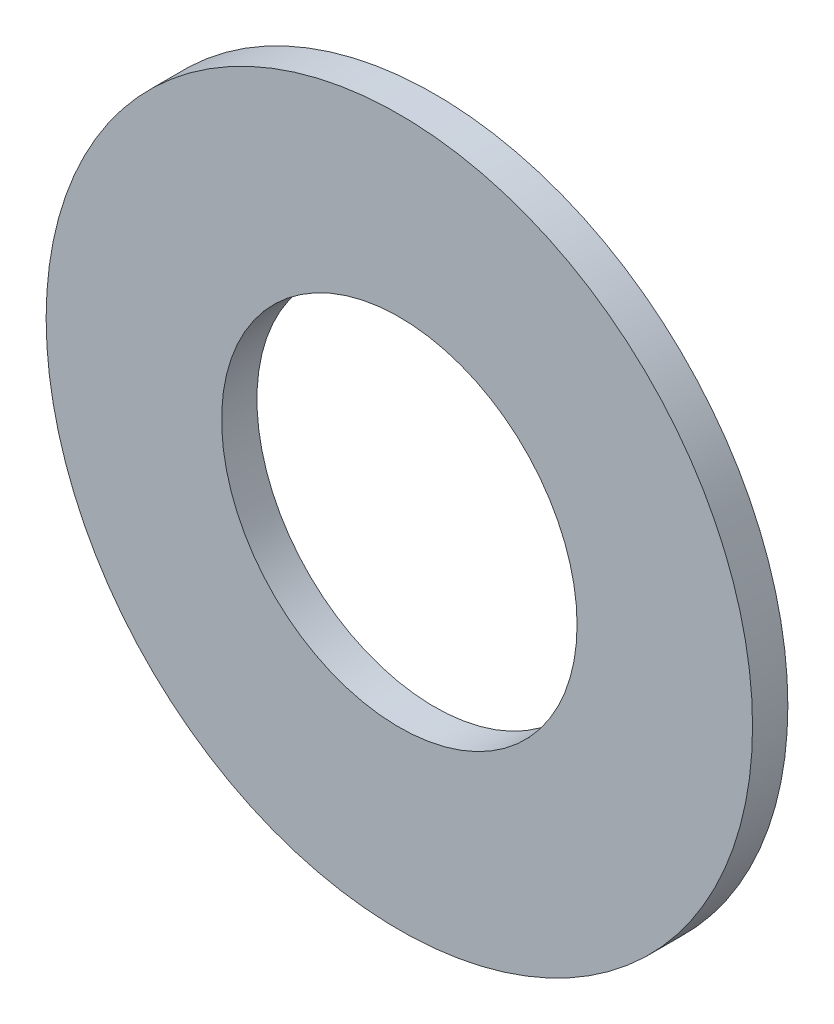
from build123d import *

# Parameters (mm, degrees)
SKETCH3_R           = 15.875
SKETCH3_R_2         = 7.9883
BOSS_EXTRUDE1_DEPTH = 0.79375


with BuildPart() as part:
    # Sketch3 → Boss-Extrude1 (new, symmetric)
    with BuildSketch(Plane.XY):
        Circle(SKETCH3_R)
        Circle(SKETCH3_R_2, mode=Mode.SUBTRACT)
    extrude(amount=BOSS_EXTRUDE1_DEPTH, both=True)


solid = part.part
